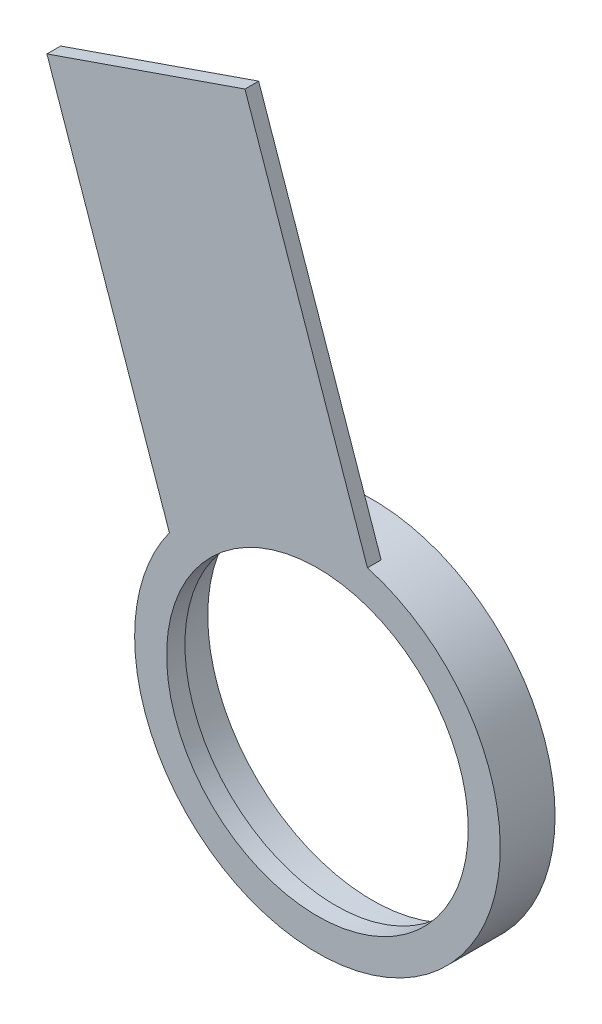
from build123d import *

# Parameters (mm, degrees)
SKETCH_1_R      = 40
SKETCH_1_R_2    = 33
EXTRUDE_1_DEPTH = 4
EXTRUDE_START   = 8
SKETCH_2_R      = 40
SKETCH_2_R_2    = 36
EXTRUDE_2_DEPTH = 8
EXTRUDE_3_DEPTH = 3


with BuildPart() as part:
    # 草图1 → 凸台-拉伸1 (new body)
    with BuildSketch(Plane.XY):
        with Locations((-86.606649797, -63.783530386)):
            Circle(SKETCH_1_R)
        with Locations((-86.606649797, -63.783530386)):
            Circle(SKETCH_1_R_2, mode=Mode.SUBTRACT)
    extrude(amount=EXTRUDE_1_DEPTH)

    # 草图2 → 凸台-拉伸2 (add)
    with BuildSketch(Plane(origin=(0, 0, 0), x_dir=(-1, 0, 0), z_dir=(0, 0, -1)).offset(EXTRUDE_START)):
        with Locations((86.606649797, -63.783530386)):
            Circle(SKETCH_2_R)
        with Locations((86.606649797, -63.783530386)):
            Circle(SKETCH_2_R_2, mode=Mode.SUBTRACT)
    extrude(amount=-EXTRUDE_2_DEPTH)

    # 草图4 → 凸台-拉伸3 (add)
    with BuildSketch(Plane.XY.offset(4)):
        with BuildLine():
            Line((-102.470674133, 52.025849932), (-145.802574452, 37.009933401))
            Line((-145.802574452, 37.009933401), (-118.238289751, -42.533185695))
            ThreePointArc((-118.238289751, -42.533185695), (-99.084005703, -27.777233919), (-74.906389432, -27.517269163))
            Line((-74.906389432, -27.517269163), (-102.470674133, 52.025849932))
        make_face()
    extrude(amount=-EXTRUDE_3_DEPTH)


solid = part.part
